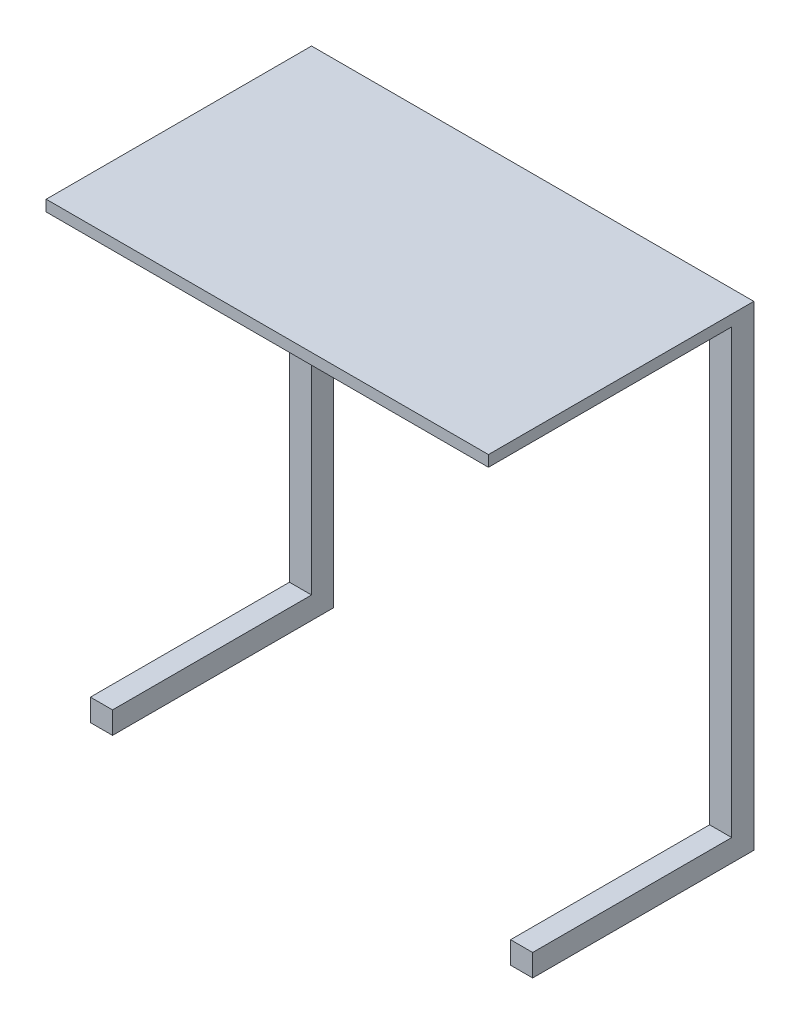
from build123d import *

# Parameters (mm, degrees)
SKETCH1_W           = 1016
SKETCH1_H           = 609.6
BOSS_EXTRUDE1_DEPTH = 25.4
SKETCH2_W           = 50.8
SKETCH2_H           = 50.8
BOSS_EXTRUDE2_DEPTH = 1016
SKETCH3_W           = 50.8
SKETCH3_H           = 508
BOSS_EXTRUDE3_DEPTH = 50.8


with BuildPart() as part:
    # Sketch1 → Boss-Extrude1 (new body)
    with BuildSketch(Plane(origin=(0, 0, 0), x_dir=(1, 0, 0), z_dir=(0, 1, 0))):
        Rectangle(SKETCH1_W, SKETCH1_H)
    extrude(amount=BOSS_EXTRUDE1_DEPTH)

    # Sketch2 → Boss-Extrude2 (add)
    with BuildSketch(Plane(origin=(0, 0, 0), x_dir=(1, 0, 0), z_dir=(0, 1, 0))):
        with Locations((-482.6, 279.4)):
            Rectangle(SKETCH2_W, SKETCH2_H)
        with Locations((482.6, 279.4)):
            Rectangle(SKETCH2_W, SKETCH2_H)
    extrude(amount=-BOSS_EXTRUDE2_DEPTH)

    # Sketch3 → Boss-Extrude3 (add)
    with BuildSketch(Plane(origin=(0, -1016, 0), x_dir=(-1, 0, 0), z_dir=(0, -1, 0))):
        with Locations((482.6, 50.8)):
            Rectangle(SKETCH3_W, SKETCH3_H)
        with Locations((-482.6, 50.8)):
            Rectangle(SKETCH3_W, SKETCH3_H)
    extrude(amount=BOSS_EXTRUDE3_DEPTH)


solid = part.part
